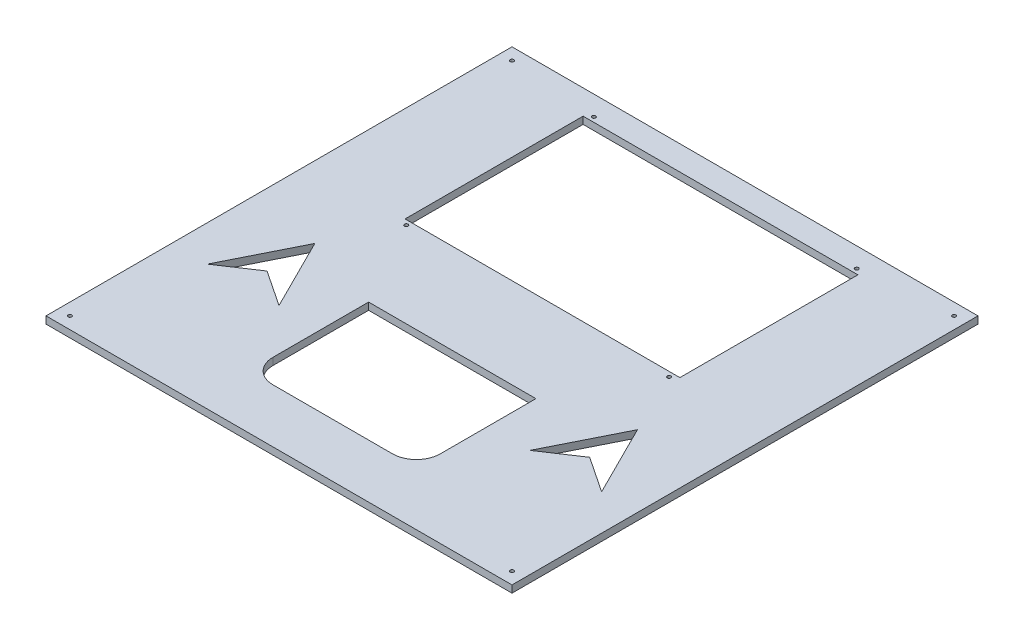
from build123d import *

# Parameters (mm, degrees)
SKETCH_1_W         = 390
SKETCH_1_H         = 390
SKETCH_1_R         = 1.5
SKETCH_1_W_2       = 230
SKETCH_1_H_2       = 149
EXTRUDE_1081_DEPTH = 6


with BuildPart() as part:
    # 草图1 → Extrude 1081 (new body)
    with BuildSketch(Plane(origin=(0, 0, 0), x_dir=(1, 0, 0), z_dir=(0, 1, 0))):
        Rectangle(SKETCH_1_W, SKETCH_1_H)
        with Locations(Location((-110, 178.5, 0), (0, 0, 270))):
            Circle(SKETCH_1_R, mode=Mode.SUBTRACT)
        with Locations(Location((-110, 21.5, 0), (0, 0, 90))):
            Circle(SKETCH_1_R, mode=Mode.SUBTRACT)
        with Locations(Location((110, 21.5, 0), (0, 0, 270))):
            Circle(SKETCH_1_R, mode=Mode.SUBTRACT)
        with Locations(Location((110, 178.5, 0), (0, 0, 90))):
            Circle(SKETCH_1_R, mode=Mode.SUBTRACT)
        with Locations(Location((-185, 185, 0), (0, 0, 270))):
            Circle(SKETCH_1_R, mode=Mode.SUBTRACT)
        with Locations(Location((-185, -185, 0), (0, 0, 90))):
            Circle(SKETCH_1_R, mode=Mode.SUBTRACT)
        with Locations(Location((185, -185, 0), (0, 0, 270))):
            Circle(SKETCH_1_R, mode=Mode.SUBTRACT)
        with Locations(Location((185, 185, 0), (0, 0, 90))):
            Circle(SKETCH_1_R, mode=Mode.SUBTRACT)
        with Locations((0, 100)):
            Rectangle(SKETCH_1_W_2, SKETCH_1_H_2, mode=Mode.SUBTRACT)
        with BuildLine():
            Line((-50, -150), (50, -150))
            ThreePointArc((50, -150), (64.142135624, -144.142135624), (70, -130))
            Line((70, -130), (70, -50))
            Line((70, -50), (-70, -50))
            Line((-70, -50), (-70, -130))
            ThreePointArc((-70, -130), (-64.142135624, -144.142135624), (-50, -150))
        make_face(mode=Mode.SUBTRACT)
        Polygon((-165, -90), (-135, -30), (-105, -90), (-135, -70), align=None, mode=Mode.SUBTRACT)
        Polygon((105, -90), (135, -30), (165, -90), (135, -70), align=None, mode=Mode.SUBTRACT)
    extrude(amount=EXTRUDE_1081_DEPTH)


solid = part.part
